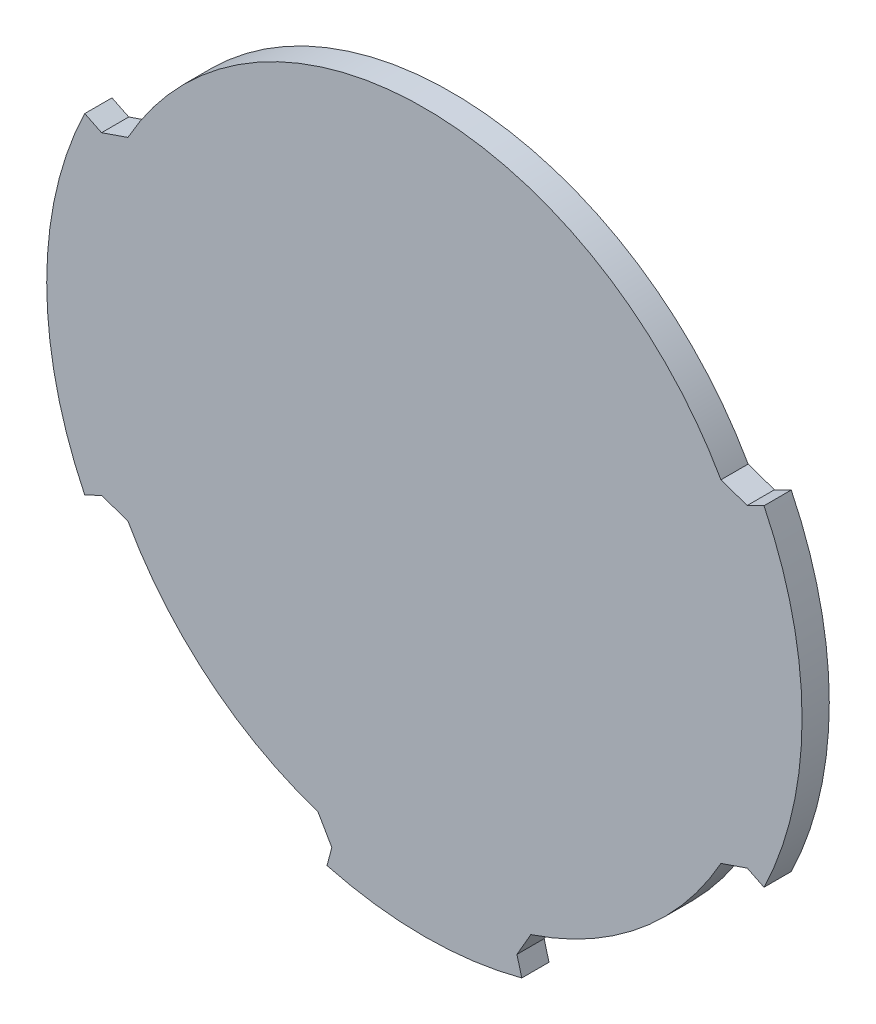
from build123d import *

# Parameters (mm, degrees)
BOSS_EXTRUDE1_DEPTH = 3.6


with BuildPart() as part:
    # Sketch1 → Boss-Extrude1 (new body)
    with BuildSketch(Plane.XY):
        with BuildLine():
            Line((-33.14651631, -29.251901051), (-33.785882697, -31.638048893))
            ThreePointArc((-33.785882697, -31.638048893), (-20.906933284, -33.326956191), (-8.027983871, -31.638048893))
            Line((-8.027983871, -31.638048893), (-8.667350258, -29.251901051))
            Line((-8.667350258, -29.251901051), (-6.827368119, -26.064958502))
            ThreePointArc((-6.827368119, -26.064958502), (7.684388547, -18.061622736), (18.309654204, -5.343596369))
            Line((18.309654204, -5.343596369), (21.789128786, -4.145517191))
            Line((21.789128786, -4.145517191), (24.009439514, -5.228435089))
            ThreePointArc((24.009439514, -5.228435089), (29.042447028, 16.622424121), (24.009439514, 38.473283331))
            Line((24.009439514, 38.473283331), (21.789128786, 37.390365433))
            Line((21.789128786, 37.390365433), (18.309654204, 38.588444611))
            ThreePointArc((18.309654204, 38.588444611), (-20.906933284, 61.571804433), (-60.123520772, 38.588444611))
            Line((-60.123520772, 38.588444611), (-63.602995354, 37.390365433))
            Line((-63.602995354, 37.390365433), (-65.823306082, 38.473283331))
            ThreePointArc((-65.823306082, 38.473283331), (-70.856313596, 16.622424121), (-65.823306082, -5.228435089))
            Line((-65.823306082, -5.228435089), (-63.602995354, -4.145517191))
            Line((-63.602995354, -4.145517191), (-60.123520772, -5.343596369))
            ThreePointArc((-60.123520772, -5.343596369), (-49.498255115, -18.061622736), (-34.986498448, -26.064958502))
            Line((-34.986498448, -26.064958502), (-33.14651631, -29.251901051))
        make_face()
    extrude(amount=BOSS_EXTRUDE1_DEPTH)


solid = part.part
